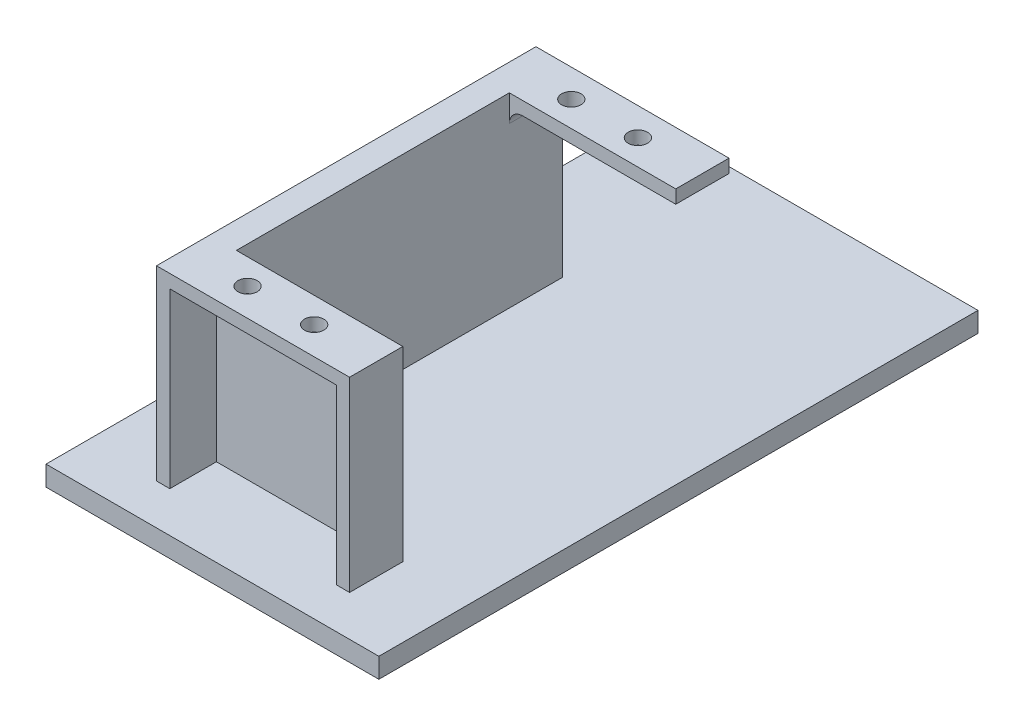
from build123d import *

# Parameters (mm, degrees)
SKETCH_1_W          = 29
SKETCH_1_H          = 57
SKETCH_1_R          = 1.45
SKETCH_1_W_2        = 21
SKETCH_1_H_2        = 41
EXTRUDE_1_DEPTH     = 28
SKETCH_2_W          = 25
SKETCH_2_H          = 26
CUT_EXTRUDE_1_DEPTH = 7
SKETCH_3_W          = 49
SKETCH_3_H          = 26
CUT_EXTRUDE_2_DEPTH = 25
SKETCH_4_W          = 4
SKETCH_4_H          = 41
CUT_EXTRUDE_3_DEPTH = 25
FILLET_1_R          = 2
SKETCH_5_W          = 50
SKETCH_5_H          = 90
EXTRUDE_2_DEPTH     = 3


with BuildPart() as part:
    # 스케치1 → 보스-돌출1 (new body)
    with BuildSketch(Plane(origin=(0, 0, 0), x_dir=(1, 0, 0), z_dir=(0, 1, 0))):
        Rectangle(SKETCH_1_W, SKETCH_1_H)
        with Locations(Location((-5, 24.31, 0), (0, 0, 270))):
            Circle(SKETCH_1_R, mode=Mode.SUBTRACT)
        with Locations(Location((-5, -24.32, 0), (0, 0, 270))):
            Circle(SKETCH_1_R, mode=Mode.SUBTRACT)
        with Locations(Location((5, -24.32, 0), (0, 0, 90))):
            Circle(SKETCH_1_R, mode=Mode.SUBTRACT)
        with Locations(Location((5, 24.31, 0), (0, 0, 90))):
            Circle(SKETCH_1_R, mode=Mode.SUBTRACT)
        Rectangle(SKETCH_1_W_2, SKETCH_1_H_2, mode=Mode.SUBTRACT)
    extrude(amount=EXTRUDE_1_DEPTH)

    # 스케치2 → 컷-돌출1 (cut)
    with BuildSketch(Plane(origin=(-14, 0, 28.5), x_dir=(-1, 0, 0), z_dir=(0, 0, -1))):
        with Locations((-14, 13)):
            Rectangle(SKETCH_2_W, SKETCH_2_H)
    extrude(amount=CUT_EXTRUDE_1_DEPTH, mode=Mode.SUBTRACT)

    # 스케치3 → 컷-돌출2 (cut)
    with BuildSketch(Plane(origin=(14.5, 0, 0), x_dir=(0, 0, -1), z_dir=(1, 0, 0))):
        with Locations((4, 13)):
            Rectangle(SKETCH_3_W, SKETCH_3_H)
    extrude(amount=-CUT_EXTRUDE_2_DEPTH, mode=Mode.SUBTRACT)

    # 스케치4 → 컷-돌출3 (cut)
    with BuildSketch(Plane(origin=(0, 28, 0), x_dir=(1, 0, 0), z_dir=(0, 1, 0))):
        with Locations((12.5, 0)):
            Rectangle(SKETCH_4_W, SKETCH_4_H)
    extrude(amount=-CUT_EXTRUDE_3_DEPTH, mode=Mode.SUBTRACT)

    # 필렛1
    fillet_1_edges = [part.edges().sort_by_distance(p)[0] for p in [
        (-10.5, 26, -24.5),
    ]]
    fillet(fillet_1_edges, radius=FILLET_1_R)

    # 스케치5 → 보스-돌출2 (add)
    with BuildSketch(Plane.XZ):
        with Locations((0, -10.4)):
            Rectangle(SKETCH_5_W, SKETCH_5_H)
    extrude(amount=EXTRUDE_2_DEPTH)


solid = part.part
